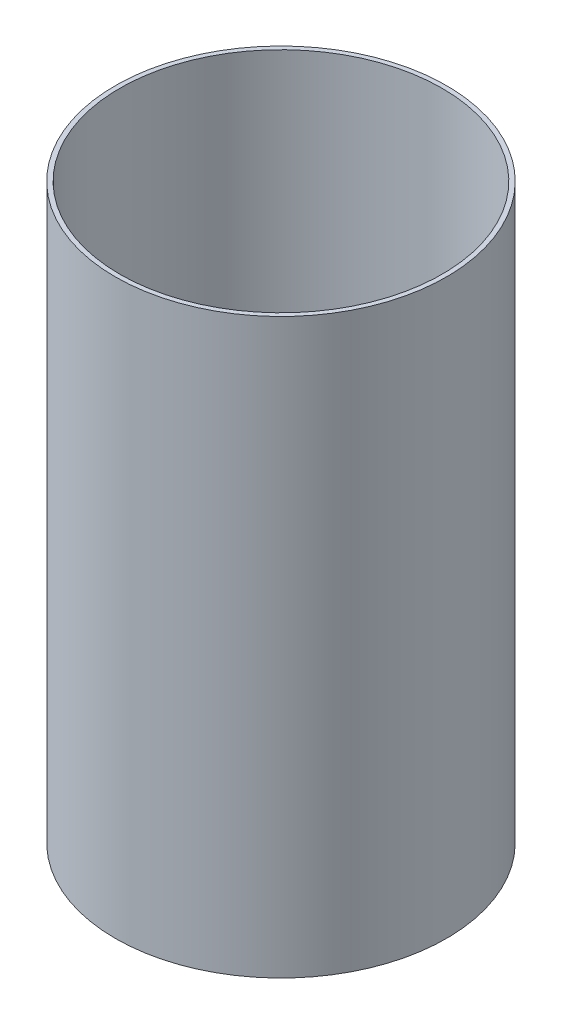
from build123d import *

# Parameters (mm, degrees)
SKETCH1_R           = 14.6875
SKETCH1_R_2         = 14.2875
BOSS_EXTRUDE1_DEPTH = 25.4


with BuildPart() as part:
    # Sketch1 → Boss-Extrude1 (new, symmetric)
    with BuildSketch(Plane(origin=(0, 0, 0), x_dir=(1, 0, 0), z_dir=(0, 1, 0))):
        with Locations(Location((0, 0, 0), (0, 0, 270))):
            Circle(SKETCH1_R)
        with Locations(Location((0, 0, 0), (0, 0, 270))):
            Circle(SKETCH1_R_2, mode=Mode.SUBTRACT)
    extrude(amount=BOSS_EXTRUDE1_DEPTH, both=True)


solid = part.part
